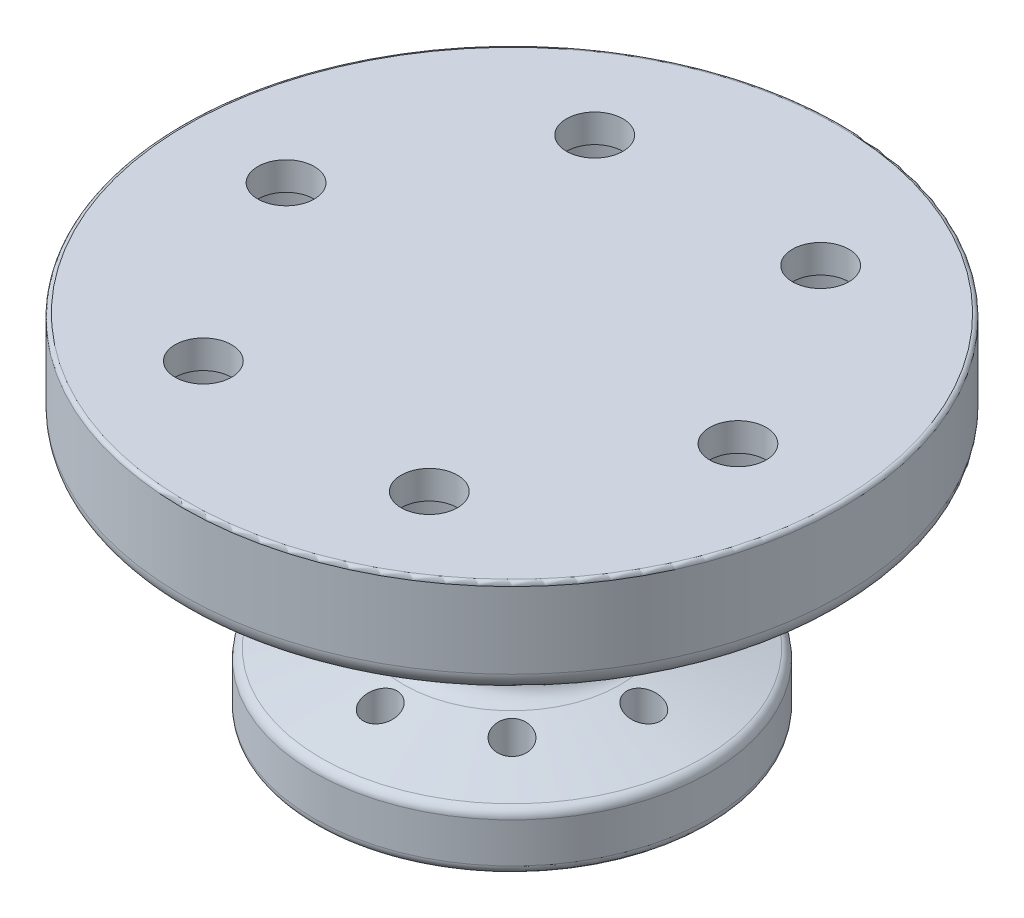
from build123d import *

# Parameters (mm, degrees)
CUT_EXTRUDE1_REACH = 32.899
SKETCH3_R          = 1.5
CUT_EXTRUDE2_REACH = 34.399
CUT_EXTRUDE2_START = -1.5
SKETCH3_3_R        = 3
SKETCH3_3_R_2      = 1.5
FILLET1_R          = 0.2
FILLET2_R          = 1
FILLET3_R          = 1
CUT_EXTRUDE3_REACH = 32.899
SKETCH4_R          = 0.9
SKETCH4_R_2        = 3.55
FILLET4_R          = 0.5


with BuildPart() as part:
    # Sketch1 → Revolve1 (revolve)
    with BuildSketch(Plane.XY):
        Polygon((0, 0), (17.5, 0), (17.5, -5), (5, -8.349364905), (5, -14.026279442), (10.5, -15.5), (10.5, -18.5), (0, -18.5), align=None)
    revolve(axis=Axis((0, 0, 0), (0, -1, 0)))

    # Sketch3 → Cut-Extrude1 (cut, up to next)
    with BuildSketch(Plane(origin=(0, 0, 0), x_dir=(1, 0, 0), z_dir=(0, 1, 0)), mode=Mode.PRIVATE) as cut_extrude1_sk1:
        with Locations((12, 0)):
            Circle(SKETCH3_R)
    cut_extrude1_tool1 = extrude(cut_extrude1_sk1.sketch, amount=-CUT_EXTRUDE1_REACH, mode=Mode.PRIVATE) & part.part
    # Sketch3 → Cut-Extrude1 (cut, up to next)
    with BuildSketch(Plane(origin=(0, 0, 0), x_dir=(1, 0, 0), z_dir=(0, 1, 0)), mode=Mode.PRIVATE) as cut_extrude1_sk2:
        with Locations((6, -10.392304845)):
            Circle(SKETCH3_R)
    cut_extrude1_tool2 = extrude(cut_extrude1_sk2.sketch, amount=-CUT_EXTRUDE1_REACH, mode=Mode.PRIVATE) & part.part
    # Sketch3 → Cut-Extrude1 (cut, up to next)
    with BuildSketch(Plane(origin=(0, 0, 0), x_dir=(1, 0, 0), z_dir=(0, 1, 0)), mode=Mode.PRIVATE) as cut_extrude1_sk3:
        with Locations((-6, -10.392304845)):
            Circle(SKETCH3_R)
    cut_extrude1_tool3 = extrude(cut_extrude1_sk3.sketch, amount=-CUT_EXTRUDE1_REACH, mode=Mode.PRIVATE) & part.part
    # Sketch3 → Cut-Extrude1 (cut, up to next)
    with BuildSketch(Plane(origin=(0, 0, 0), x_dir=(1, 0, 0), z_dir=(0, 1, 0)), mode=Mode.PRIVATE) as cut_extrude1_sk4:
        with Locations((-12, 0)):
            Circle(SKETCH3_R)
    cut_extrude1_tool4 = extrude(cut_extrude1_sk4.sketch, amount=-CUT_EXTRUDE1_REACH, mode=Mode.PRIVATE) & part.part
    # Sketch3 → Cut-Extrude1 (cut, up to next)
    with BuildSketch(Plane(origin=(0, 0, 0), x_dir=(1, 0, 0), z_dir=(0, 1, 0)), mode=Mode.PRIVATE) as cut_extrude1_sk5:
        with Locations((-6, 10.392304845)):
            Circle(SKETCH3_R)
    cut_extrude1_tool5 = extrude(cut_extrude1_sk5.sketch, amount=-CUT_EXTRUDE1_REACH, mode=Mode.PRIVATE) & part.part
    # Sketch3 → Cut-Extrude1 (cut, up to next)
    with BuildSketch(Plane(origin=(0, 0, 0), x_dir=(1, 0, 0), z_dir=(0, 1, 0)), mode=Mode.PRIVATE) as cut_extrude1_sk6:
        with Locations((6, 10.392304845)):
            Circle(SKETCH3_R)
    cut_extrude1_tool6 = extrude(cut_extrude1_sk6.sketch, amount=-CUT_EXTRUDE1_REACH, mode=Mode.PRIVATE) & part.part
    add(cut_extrude1_tool1.solids().sort_by_distance((12, 0, 0))[0], mode=Mode.SUBTRACT)
    add(cut_extrude1_tool2.solids().sort_by_distance((6, 0, 10.392305))[0], mode=Mode.SUBTRACT)
    add(cut_extrude1_tool3.solids().sort_by_distance((-6, 0, 10.392305))[0], mode=Mode.SUBTRACT)
    add(cut_extrude1_tool4.solids().sort_by_distance((-12, 0, 0))[0], mode=Mode.SUBTRACT)
    add(cut_extrude1_tool5.solids().sort_by_distance((-6, 0, -10.392305))[0], mode=Mode.SUBTRACT)
    add(cut_extrude1_tool6.solids().sort_by_distance((6, 0, -10.392305))[0], mode=Mode.SUBTRACT)

    # Sketch3<3> → Cut-Extrude2 (cut, up to next)
    with BuildSketch(Plane(origin=(0, 0, 0), x_dir=(1, 0, 0), z_dir=(0, 1, 0)).offset(CUT_EXTRUDE2_START), mode=Mode.PRIVATE) as cut_extrude2_sk1:
        with Locations((12, 0)):
            Circle(SKETCH3_3_R)
        with Locations((12, 0)):
            Circle(SKETCH3_3_R_2, mode=Mode.SUBTRACT)
    cut_extrude2_tool1 = extrude(cut_extrude2_sk1.sketch, amount=-CUT_EXTRUDE2_REACH, mode=Mode.PRIVATE) & part.part
    # Sketch3<3> → Cut-Extrude2 (cut, up to next)
    with BuildSketch(Plane(origin=(0, 0, 0), x_dir=(1, 0, 0), z_dir=(0, 1, 0)).offset(CUT_EXTRUDE2_START), mode=Mode.PRIVATE) as cut_extrude2_sk2:
        with Locations((6, -10.392304845)):
            Circle(SKETCH3_3_R)
        with Locations((6, -10.392304845)):
            Circle(SKETCH3_3_R_2, mode=Mode.SUBTRACT)
    cut_extrude2_tool2 = extrude(cut_extrude2_sk2.sketch, amount=-CUT_EXTRUDE2_REACH, mode=Mode.PRIVATE) & part.part
    # Sketch3<3> → Cut-Extrude2 (cut, up to next)
    with BuildSketch(Plane(origin=(0, 0, 0), x_dir=(1, 0, 0), z_dir=(0, 1, 0)).offset(CUT_EXTRUDE2_START), mode=Mode.PRIVATE) as cut_extrude2_sk3:
        with Locations((-6, -10.392304845)):
            Circle(SKETCH3_3_R)
    cut_extrude2_tool3 = extrude(cut_extrude2_sk3.sketch, amount=-CUT_EXTRUDE2_REACH, mode=Mode.PRIVATE) & part.part
    # Sketch3<3> → Cut-Extrude2 (cut, up to next)
    with BuildSketch(Plane(origin=(0, 0, 0), x_dir=(1, 0, 0), z_dir=(0, 1, 0)).offset(CUT_EXTRUDE2_START), mode=Mode.PRIVATE) as cut_extrude2_sk4:
        with Locations((-12, 0)):
            Circle(SKETCH3_3_R)
        with Locations((-12, 0)):
            Circle(SKETCH3_3_R_2, mode=Mode.SUBTRACT)
    cut_extrude2_tool4 = extrude(cut_extrude2_sk4.sketch, amount=-CUT_EXTRUDE2_REACH, mode=Mode.PRIVATE) & part.part
    # Sketch3<3> → Cut-Extrude2 (cut, up to next)
    with BuildSketch(Plane(origin=(0, 0, 0), x_dir=(1, 0, 0), z_dir=(0, 1, 0)).offset(CUT_EXTRUDE2_START), mode=Mode.PRIVATE) as cut_extrude2_sk5:
        with Locations((-6, 10.392304845)):
            Circle(SKETCH3_3_R)
        with Locations((-6, 10.392304845)):
            Circle(SKETCH3_3_R_2, mode=Mode.SUBTRACT)
    cut_extrude2_tool5 = extrude(cut_extrude2_sk5.sketch, amount=-CUT_EXTRUDE2_REACH, mode=Mode.PRIVATE) & part.part
    # Sketch3<3> → Cut-Extrude2 (cut, up to next)
    with BuildSketch(Plane(origin=(0, 0, 0), x_dir=(1, 0, 0), z_dir=(0, 1, 0)).offset(CUT_EXTRUDE2_START), mode=Mode.PRIVATE) as cut_extrude2_sk6:
        with Locations((6, 10.392304845)):
            Circle(SKETCH3_3_R)
    cut_extrude2_tool6 = extrude(cut_extrude2_sk6.sketch, amount=-CUT_EXTRUDE2_REACH, mode=Mode.PRIVATE) & part.part
    add(cut_extrude2_tool1.solids().sort_by_distance((9.084853, -1.5, 0))[0], mode=Mode.SUBTRACT)
    add(cut_extrude2_tool2.solids().sort_by_distance((3.084853, -1.5, 10.392305))[0], mode=Mode.SUBTRACT)
    add(cut_extrude2_tool3.solids().sort_by_distance((-6, -1.5, 10.392305))[0], mode=Mode.SUBTRACT)
    add(cut_extrude2_tool4.solids().sort_by_distance((-14.915147, -1.5, 0))[0], mode=Mode.SUBTRACT)
    add(cut_extrude2_tool5.solids().sort_by_distance((-8.915147, -1.5, -10.392305))[0], mode=Mode.SUBTRACT)
    add(cut_extrude2_tool6.solids().sort_by_distance((6, -1.5, -10.392305))[0], mode=Mode.SUBTRACT)

    # Fillet1
    fillet1_edges = [part.edges().sort_by_distance(p)[0] for p in [
        (-17.5, 0, 0),
    ]]
    fillet(fillet1_edges, radius=FILLET1_R)

    # Fillet2
    fillet2_edges = [part.edges().sort_by_distance(p)[0] for p in [
        (-17.5, -5, 0),
    ]]
    fillet(fillet2_edges, radius=FILLET2_R)

    # Fillet3
    fillet3_edges = [part.edges().sort_by_distance(p)[0] for p in [
        (-5, -8.349364905, 0),
        (-5, -14.026279442, 0),
    ]]
    fillet(fillet3_edges, radius=FILLET3_R)

    # Cut-Extrude3: up to this cone (the profile starts inside it)
    cut_extrude3_end = Plane(origin=(0, -18.5, 0), z_dir=(0, -1, 0)).offset(-5.813465521) * Cone(3.732e-06, 227.314060515, 60.908617943, align=(Align.CENTER, Align.CENTER, Align.MIN), mode=Mode.PRIVATE)
    # Sketch4 → Cut-Extrude3 (cut, up to the surface)
    with BuildSketch(Plane.XZ.offset(18.5), mode=Mode.PRIVATE) as cut_extrude3_sk1:
        with Locations((7, 0)):
            Circle(SKETCH4_R)
    cut_extrude3_tool1 = extrude(cut_extrude3_sk1.sketch, amount=-CUT_EXTRUDE3_REACH, mode=Mode.PRIVATE) & cut_extrude3_end
    add(cut_extrude3_tool1.solids().sort_by_distance((7, -18.5, 0))[0], mode=Mode.SUBTRACT)
    # Sketch4 → Cut-Extrude3 (cut, up to the surface)
    with BuildSketch(Plane.XZ.offset(18.5), mode=Mode.PRIVATE) as cut_extrude3_sk2:
        with Locations((4.949747468, -4.949747468)):
            Circle(SKETCH4_R)
    cut_extrude3_tool2 = extrude(cut_extrude3_sk2.sketch, amount=-CUT_EXTRUDE3_REACH, mode=Mode.PRIVATE) & cut_extrude3_end
    add(cut_extrude3_tool2.solids().sort_by_distance((4.949747, -18.5, -4.949747))[0], mode=Mode.SUBTRACT)
    # Sketch4 → Cut-Extrude3 (cut, up to the surface)
    with BuildSketch(Plane.XZ.offset(18.5), mode=Mode.PRIVATE) as cut_extrude3_sk3:
        with Locations((0, -7)):
            Circle(SKETCH4_R)
    cut_extrude3_tool3 = extrude(cut_extrude3_sk3.sketch, amount=-CUT_EXTRUDE3_REACH, mode=Mode.PRIVATE) & cut_extrude3_end
    add(cut_extrude3_tool3.solids().sort_by_distance((0, -18.5, -7))[0], mode=Mode.SUBTRACT)
    # Sketch4 → Cut-Extrude3 (cut, up to the surface)
    with BuildSketch(Plane.XZ.offset(18.5), mode=Mode.PRIVATE) as cut_extrude3_sk4:
        with Locations((-4.949747468, -4.949747468)):
            Circle(SKETCH4_R)
    cut_extrude3_tool4 = extrude(cut_extrude3_sk4.sketch, amount=-CUT_EXTRUDE3_REACH, mode=Mode.PRIVATE) & cut_extrude3_end
    add(cut_extrude3_tool4.solids().sort_by_distance((-4.949747, -18.5, -4.949747))[0], mode=Mode.SUBTRACT)
    # Sketch4 → Cut-Extrude3 (cut, up to the surface)
    with BuildSketch(Plane.XZ.offset(18.5), mode=Mode.PRIVATE) as cut_extrude3_sk5:
        with Locations((-7, 0)):
            Circle(SKETCH4_R)
    cut_extrude3_tool5 = extrude(cut_extrude3_sk5.sketch, amount=-CUT_EXTRUDE3_REACH, mode=Mode.PRIVATE) & cut_extrude3_end
    add(cut_extrude3_tool5.solids().sort_by_distance((-7, -18.5, 0))[0], mode=Mode.SUBTRACT)
    # Sketch4 → Cut-Extrude3 (cut, up to the surface)
    with BuildSketch(Plane.XZ.offset(18.5), mode=Mode.PRIVATE) as cut_extrude3_sk6:
        with Locations((-4.949747468, 4.949747468)):
            Circle(SKETCH4_R)
    cut_extrude3_tool6 = extrude(cut_extrude3_sk6.sketch, amount=-CUT_EXTRUDE3_REACH, mode=Mode.PRIVATE) & cut_extrude3_end
    add(cut_extrude3_tool6.solids().sort_by_distance((-4.949747, -18.5, 4.949747))[0], mode=Mode.SUBTRACT)
    # Sketch4 → Cut-Extrude3 (cut, up to the surface)
    with BuildSketch(Plane.XZ.offset(18.5), mode=Mode.PRIVATE) as cut_extrude3_sk7:
        with Locations((0, 7)):
            Circle(SKETCH4_R)
    cut_extrude3_tool7 = extrude(cut_extrude3_sk7.sketch, amount=-CUT_EXTRUDE3_REACH, mode=Mode.PRIVATE) & cut_extrude3_end
    add(cut_extrude3_tool7.solids().sort_by_distance((0, -18.5, 7))[0], mode=Mode.SUBTRACT)
    # Sketch4 → Cut-Extrude3 (cut, up to the surface)
    with BuildSketch(Plane.XZ.offset(18.5), mode=Mode.PRIVATE) as cut_extrude3_sk8:
        with Locations((4.949747468, 4.949747468)):
            Circle(SKETCH4_R)
    cut_extrude3_tool8 = extrude(cut_extrude3_sk8.sketch, amount=-CUT_EXTRUDE3_REACH, mode=Mode.PRIVATE) & cut_extrude3_end
    add(cut_extrude3_tool8.solids().sort_by_distance((4.949747, -18.5, 4.949747))[0], mode=Mode.SUBTRACT)
    # Sketch4 → Cut-Extrude3 (cut, up to the surface)
    with BuildSketch(Plane.XZ.offset(18.5), mode=Mode.PRIVATE) as cut_extrude3_sk9:
        Circle(SKETCH4_R_2)
    cut_extrude3_tool9 = extrude(cut_extrude3_sk9.sketch, amount=-CUT_EXTRUDE3_REACH, mode=Mode.PRIVATE) & cut_extrude3_end
    add(cut_extrude3_tool9.solids().sort_by_distance((0, -18.5, 0))[0], mode=Mode.SUBTRACT)

    # Fillet4
    fillet4_edges = [part.edges().sort_by_distance(p)[0] for p in [
        (-10.5, -18.5, 0),
        (-10.5, -15.5, 0),
    ]]
    fillet(fillet4_edges, radius=FILLET4_R)


solid = part.part
